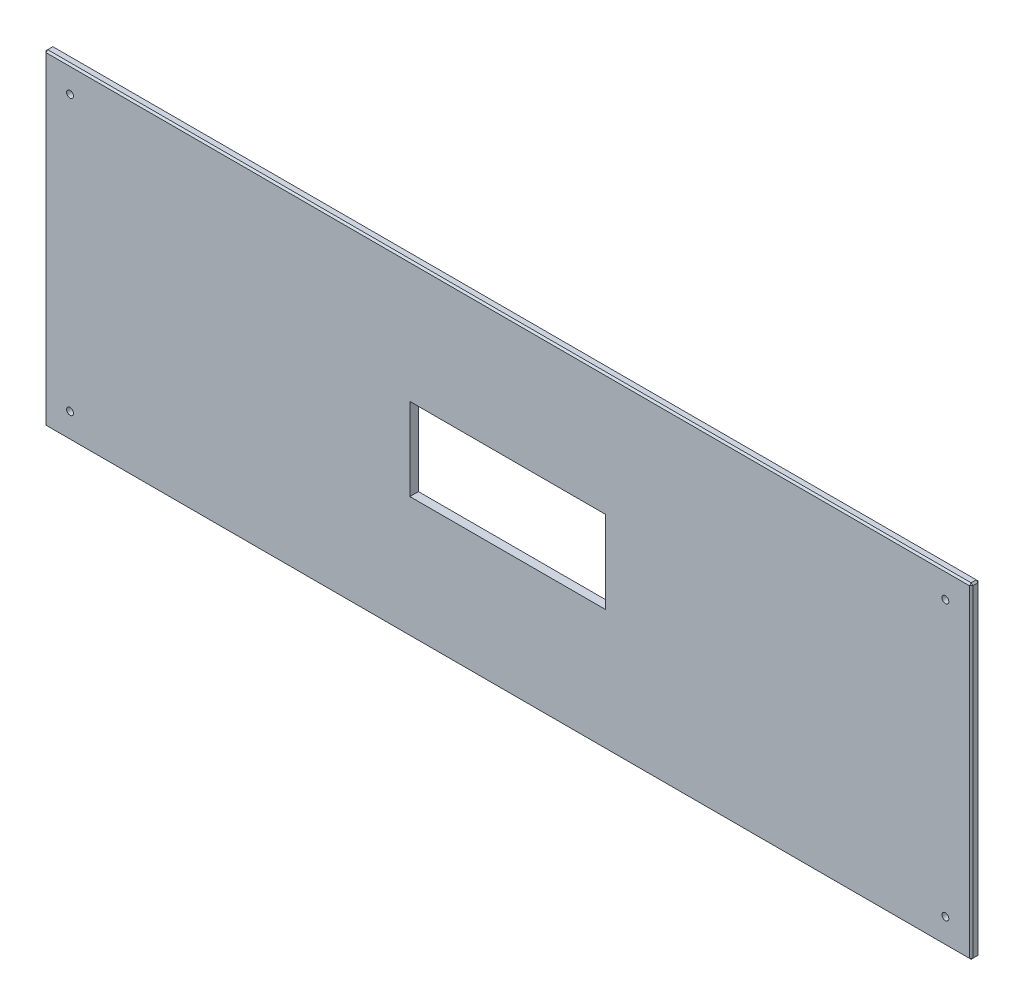
from build123d import *

# Parameters (mm, degrees)
SKETCH1_W           = 540
SKETCH1_H           = 190
BOSS_EXTRUDE1_DEPTH = 5
CHAMFER1_SIZE       = 1
SKETCH2_R           = 2
CUT_EXTRUDE1_DEPTH  = 5
SKETCH3_W           = 114
SKETCH3_H           = 48
CUT_EXTRUDE2_DEPTH  = 10


with BuildPart() as part:
    # Sketch1 → Boss-Extrude1 (new body)
    with BuildSketch(Plane.XY):
        with Locations((270, 95)):
            Rectangle(SKETCH1_W, SKETCH1_H)
    extrude(amount=BOSS_EXTRUDE1_DEPTH)

    # Chamfer1
    chamfer1_edges = [part.edges().sort_by_distance(p)[0] for p in [
        (540, 95, 5),
        (270, 190, 5),
        (0, 95, 5),
        (270, 190, 0),
        (540, 95, 0),
        (270, 0, 0),
        (0, 95, 0),
        (0, 190, 2.5),
        (540, 190, 2.5),
        (540, 0, 2.5),
        (0, 0, 2.5),
        (270, 0, 5),
    ]]
    chamfer(chamfer1_edges, length=CHAMFER1_SIZE)

    # Sketch2 → Cut-Extrude1 (cut)
    with BuildSketch(Plane.XY.offset(5)):
        with Locations((525, 175)):
            Circle(SKETCH2_R)
        with Locations((525, 15)):
            Circle(SKETCH2_R)
        with Locations((15, 175)):
            Circle(SKETCH2_R)
        with Locations((15, 15)):
            Circle(SKETCH2_R)
    extrude(amount=-CUT_EXTRUDE1_DEPTH, mode=Mode.SUBTRACT)

    # Sketch3 → Cut-Extrude2 (cut)
    with BuildSketch(Plane.XY.offset(5)):
        with Locations((270, 95)):
            Rectangle(SKETCH3_W, SKETCH3_H)
    extrude(amount=-CUT_EXTRUDE2_DEPTH, mode=Mode.SUBTRACT)


solid = part.part
